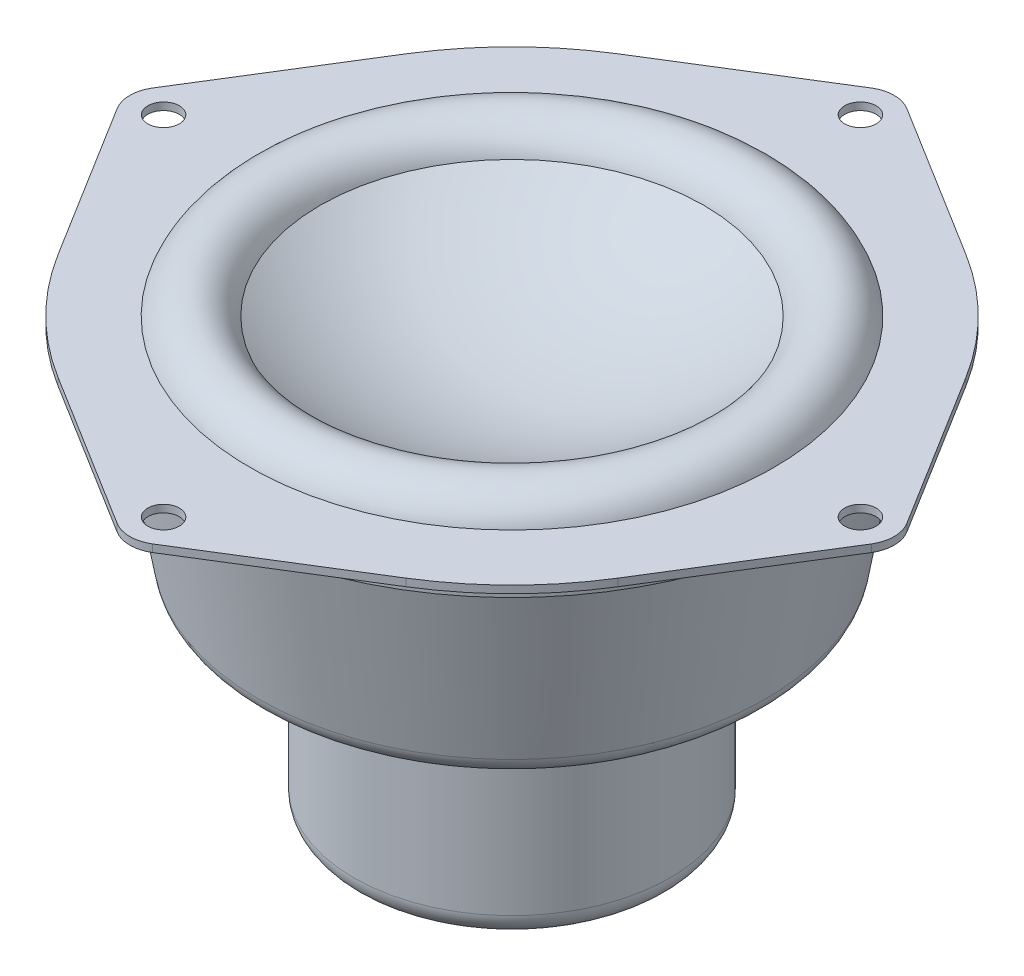
from build123d import *
from build123d.topology import SkipClean

# Parameters (mm, degrees)
SKETCH1_R           = 21.1
BOSS_EXTRUDE1_DEPTH = 27.6
SKETCH2_R           = 38.25
BOSS_EXTRUDE2_DEPTH = 27.3
SKETCH3_R           = 42.5
BOSS_EXTRUDE3_DEPTH = 1.5
SKETCH4_R           = 2.1
BOSS_EXTRUDE4_DEPTH = 1
CIRPATTERN1_COUNT   = 4
DRAFT1_ANGLE        = 10
FILLET1_R           = 3
FILLET2_R           = 3


with BuildPart() as part:
    # Sketch1 → Boss-Extrude1 (new body)
    with BuildSketch(Plane(origin=(0, 0, 0), x_dir=(1, 0, 0), z_dir=(0, 1, 0))):
        with Locations(Location((0, 0, 0), (0, 0, 90))):
            Circle(SKETCH1_R)
    extrude(amount=BOSS_EXTRUDE1_DEPTH)

    # Sketch2 → Boss-Extrude2 (add)
    with BuildSketch(Plane(origin=(0, 27.6, 0), x_dir=(1, 0, 0), z_dir=(0, 1, 0))):
        with Locations(Location((0, 0, 0), (0, 0, 270))):
            Circle(SKETCH2_R)
    extrude(amount=BOSS_EXTRUDE2_DEPTH)

    # Sketch3 → Boss-Extrude3 (add)
    with BuildSketch(Plane(origin=(0, 54.9, 0), x_dir=(1, 0, 0), z_dir=(0, 1, 0))):
        with Locations(Location((0, 0, 0), (0, 0, 270))):
            Circle(SKETCH3_R)
    extrude(amount=BOSS_EXTRUDE3_DEPTH)

    # Sketch4 → Boss-Extrude4 (add)
    with BuildSketch(Plane(origin=(0, 56.4, 0), x_dir=(1, 0, 0), z_dir=(0, 1, 0))):
        with BuildLine():
            Line((-23.216565266, 37.376344086), (-2.374421448, 50.322580645))
            ThreePointArc((-2.374421448, 50.322580645), (0, 51), (2.374421448, 50.322580645))
            Line((2.374421448, 50.322580645), (23.216565266, 37.376344086))
            ThreePointArc((23.216565266, 37.376344086), (0, -44), (-23.216565266, 37.376344086))
        make_face()
        with Locations(Location((0, 46.5, 0), (0, 0, 270))):
            Circle(SKETCH4_R, mode=Mode.SUBTRACT)
    boss_extrude4 = extrude(amount=BOSS_EXTRUDE4_DEPTH)

    # CirPattern1: Boss-Extrude4 ×4 about axis
    cirpattern1_axis = Axis((0, 0, 0), (0, 1, 0))
    for i in range(1, CIRPATTERN1_COUNT):
        add(boss_extrude4.rotate(cirpattern1_axis, i * 360 / CIRPATTERN1_COUNT))

    # Draft1
    draft1_faces = [part.faces().sort_by_distance(p)[0] for p in [
        (0, 41.25, -38.25),
    ]]
    draft(draft1_faces, Plane(origin=(0, 54.9, 0), x_dir=(0, 0, -1), z_dir=(0, -1, 0)), DRAFT1_ANGLE)

    # Fillet1
    fillet1_edges = [part.edges().sort_by_distance(p)[0] for p in [
        (0, 0, 21.1),
    ]]
    fillet(fillet1_edges, radius=FILLET1_R)

    # Fillet2
    fillet2_edges = [part.edges().sort_by_distance(p)[0] for p in [
        (0, 27.6, -33.436273427),
    ]]
    fillet(fillet2_edges, radius=FILLET2_R)

    # Sketch6 → Cut-Revolve1 (revolve, cut)
    with BuildSketch(Plane(origin=(0, 0, 0), x_dir=(0, 0, -1), z_dir=(1, 0, 0))):
        with BuildLine():
            ThreePointArc((25.599913717, 57.391292677), (25.601491738, 57.395647071), (25.603073792, 57.4))
            Line((25.603073792, 57.4), (23.216565266, 57.4))
            Line((23.216565266, 57.4), (2.374421448, 57.4))
            Line((2.374421448, 57.4), (0, 57.4))
            Line((0, 57.4), (0, 49.4))
            ThreePointArc((0, 49.4), (13.409104565, 51.444256324), (25.599913717, 57.391292677))
        make_face()
    revolve(axis=Axis((0, 49.4, 0), (0, 1, 0)), mode=Mode.SUBTRACT)

    # Sketch6<4> → Revolve1 (revolve)
    with SkipClean():  # the faces are left unmerged after this step: merging them gives an invalid solid
        with BuildSketch(Plane(origin=(0, 0, 0), x_dir=(0, 0, -1), z_dir=(1, 0, 0))):
            with BuildLine():
                Line((25.603073792, 57.4), (35, 57.4))
                ThreePointArc((35, 57.4), (30.301536896, 60.689899283), (25.603073792, 57.4))
            make_face()
        revolve(axis=Axis((0, 49.4, 0), (0, 1, 0)))


solid = part.part
